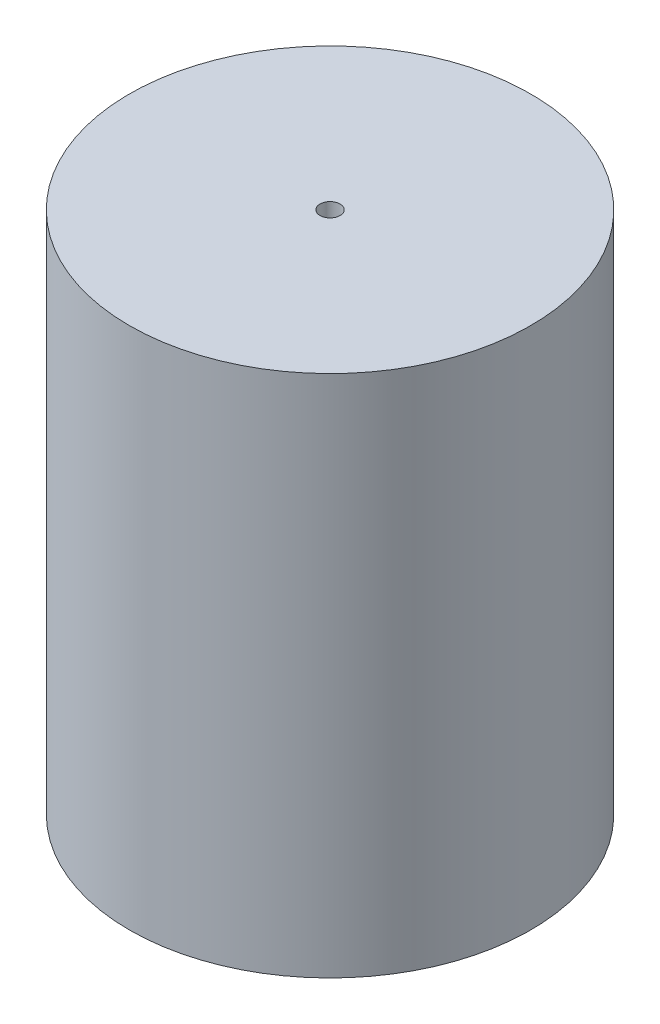
from build123d import *

# Parameters (mm, degrees)
SKETCH1_R           = 23
BOSS_EXTRUDE1_DEPTH = 60
SKETCH2_R           = 20
CUT_EXTRUDE1_DEPTH  = 48
SKETCH3_R           = 1.15
CUT_EXTRUDE2_DEPTH  = 50


with BuildPart() as part:
    # Sketch1 → Boss-Extrude1 (new body)
    with BuildSketch(Plane(origin=(0, 0, 0), x_dir=(1, 0, 0), z_dir=(0, 1, 0))):
        with Locations(Location((0, 0, 0), (0, 0, 270))):
            Circle(SKETCH1_R)
    extrude(amount=BOSS_EXTRUDE1_DEPTH)

    # Sketch2 → Cut-Extrude1 (cut)
    with BuildSketch(Plane.XZ):
        with Locations(Location((0, 0, 0), (0, 0, 270))):
            Circle(SKETCH2_R)
    extrude(amount=-CUT_EXTRUDE1_DEPTH, mode=Mode.SUBTRACT)

    # Sketch3 → Cut-Extrude2 (cut)
    with BuildSketch(Plane(origin=(0, 60, 0), x_dir=(1, 0, 0), z_dir=(0, 1, 0))):
        with Locations(Location((0, 0, 0), (0, 0, 270))):
            Circle(SKETCH3_R)
    extrude(amount=-CUT_EXTRUDE2_DEPTH, mode=Mode.SUBTRACT)


solid = part.part
